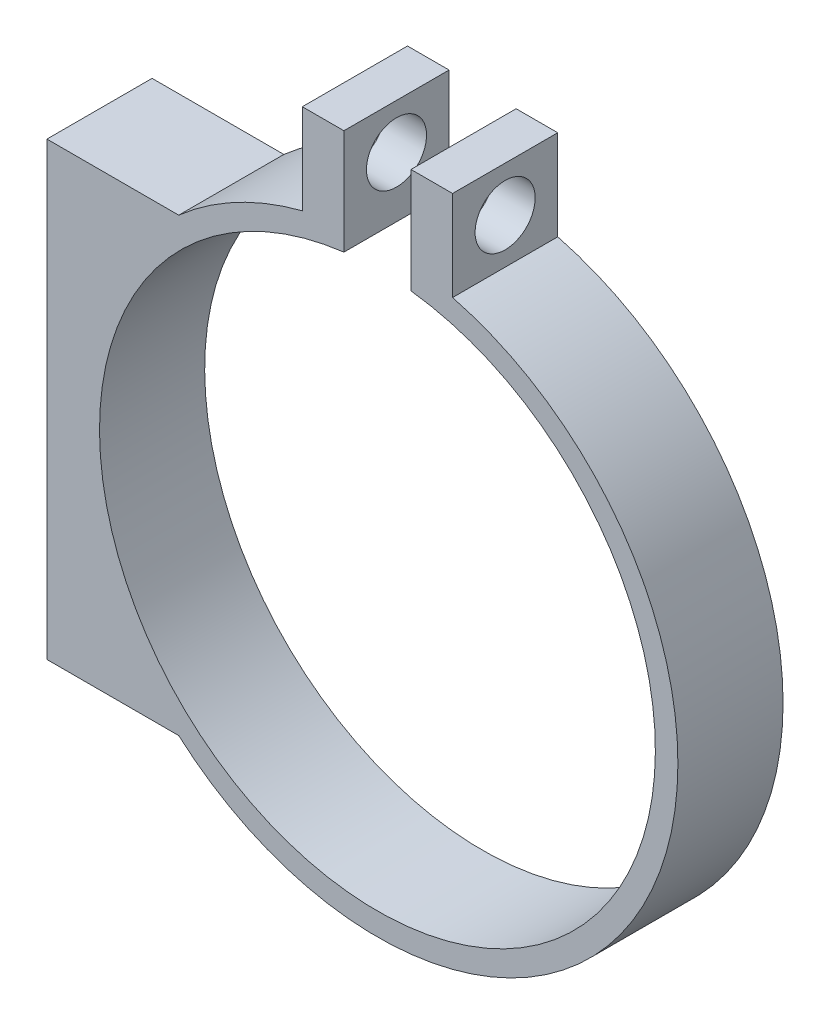
from build123d import *

# Parameters (mm, degrees)
BOSS_EXTRUDE1_DEPTH = 7
SKETCH2_R           = 1.75
CUT_EXTRUDE2_DEPTH  = 5
SKETCH3_R           = 2
CUT_EXTRUDE3_DEPTH  = 15


with BuildPart() as part:
    # Sketch1 → Boss-Extrude1 (new body)
    with BuildSketch(Plane.XY):
        with BuildLine():
            Line((-22, -15), (-22, 15))
            Line((-22, 15), (-13.228756555, 15))
            ThreePointArc((-13.228756555, 15), (-9.372033712, 17.668191308), (-5, 19.364916731))
            Line((-5, 19.364916731), (-5, 25.364916731))
            Line((-5, 25.364916731), (-2.231554046, 25.364916731))
            Line((-2.231554046, 25.364916731), (-2.231554046, 18.364916731))
            ThreePointArc((-2.231554046, 18.364916731), (0, -18.5), (2.231554046, 18.364916731))
            Line((2.231554046, 18.364916731), (2.231554046, 25.364916731))
            Line((2.231554046, 25.364916731), (5, 25.364916731))
            Line((5, 25.364916731), (5, 19.364916731))
            ThreePointArc((5, 19.364916731), (17.668191308, -9.372033712), (-13.228756555, -15))
            Line((-13.228756555, -15), (-22, -15))
        make_face()
    extrude(amount=BOSS_EXTRUDE1_DEPTH)

    # Sketch2 → Cut-Extrude2 (cut)
    with BuildSketch(Plane.ZY.offset(22)):
        with Locations((3.5, 12.5)):
            Circle(SKETCH2_R)
        with Locations((3.5, -12.5)):
            Circle(SKETCH2_R)
    extrude(amount=-CUT_EXTRUDE2_DEPTH, mode=Mode.SUBTRACT)

    # Sketch3 → Cut-Extrude3 (cut)
    with BuildSketch(Plane.ZY.offset(5)):
        with Locations(Location((3.5, 22.364916731, 0), (0, 0, 270))):
            Circle(SKETCH3_R)
    extrude(amount=-CUT_EXTRUDE3_DEPTH, mode=Mode.SUBTRACT)


solid = part.part
